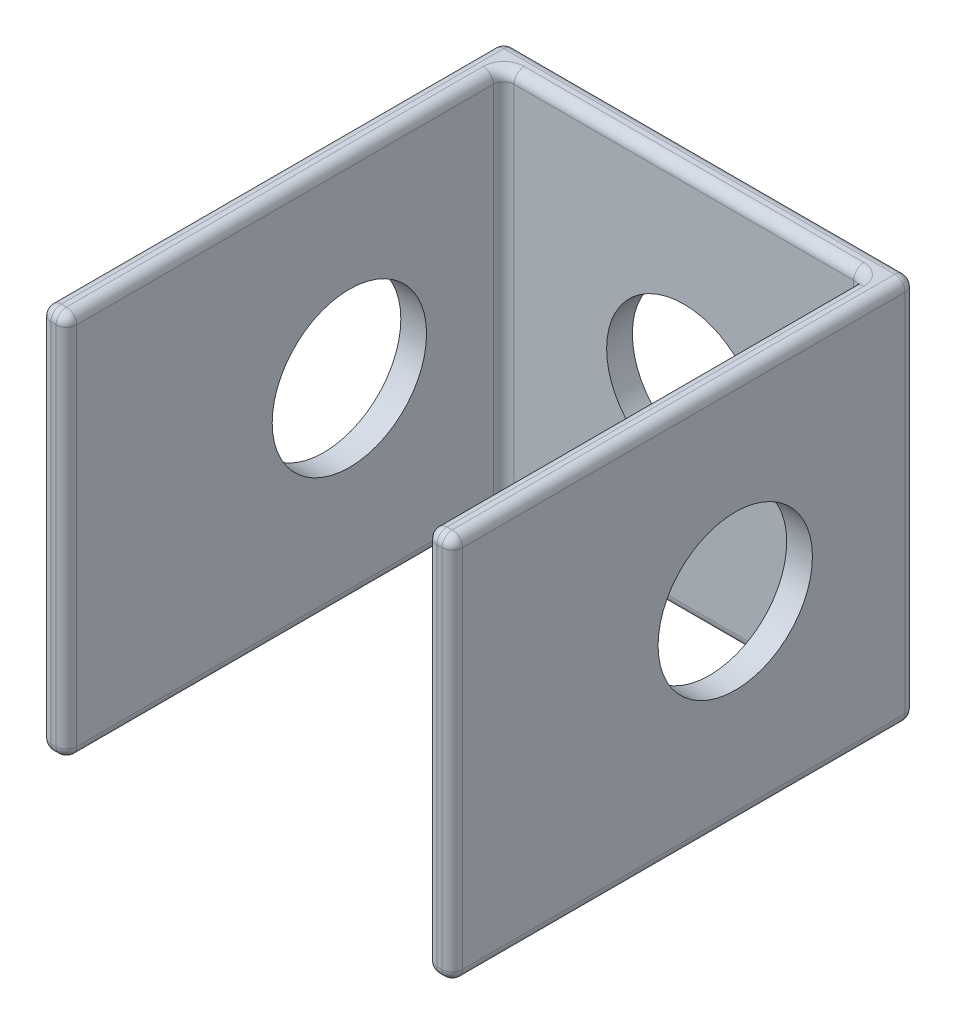
from build123d import *

# Parameters (mm, degrees)
SKETCH1_W           = 80
SKETCH1_H           = 90
BOSS_EXTRUDE1_DEPTH = 75
SKETCH2_W           = 70
SKETCH2_H           = 85
CUT_EXTRUDE2_DEPTH  = 142.862609591
SKETCH3_R           = 15
CUT_EXTRUDE3_DEPTH  = 142.862609591
SKETCH4_R           = 15
CUT_EXTRUDE4_DEPTH  = 139.744369255
FILLET1_R           = 2


with BuildPart() as part:
    # Sketch1 → Boss-Extrude1 (new body)
    with BuildSketch(Plane(origin=(0, 0, 0), x_dir=(1, 0, 0), z_dir=(0, 1, 0))):
        with Locations((40, 45)):
            Rectangle(SKETCH1_W, SKETCH1_H)
    extrude(amount=BOSS_EXTRUDE1_DEPTH)

    # Sketch2 → Cut-Extrude2 (cut, through all)
    with BuildSketch(Plane(origin=(0, 75, 0), x_dir=(1, 0, 0), z_dir=(0, 1, 0))):
        with Locations((40, 42.5)):
            Rectangle(SKETCH2_W, SKETCH2_H)
    extrude(amount=-CUT_EXTRUDE2_DEPTH, mode=Mode.SUBTRACT)

    # Sketch3 → Cut-Extrude3 (cut, through all)
    with BuildSketch(Plane.ZY):
        with Locations((-55, 37.5)):
            Circle(SKETCH3_R)
    extrude(amount=-CUT_EXTRUDE3_DEPTH, mode=Mode.SUBTRACT)

    # Sketch4 → Cut-Extrude4 (cut, through all)
    with BuildSketch(Plane.XY.offset(-85)):
        with Locations((40, 37.5)):
            Circle(SKETCH4_R)
    extrude(amount=-CUT_EXTRUDE4_DEPTH, mode=Mode.SUBTRACT)

    # Fillet1
    fillet1_edges = [part.edges().sort_by_distance(p)[0] for p in [
        (80, 75, -45),
        (77.5, 0, 0),
        (40, 75, -90),
        (77.5, 75, 0),
        (75, 37.5, 0),
        (5, 0, -42.5),
        (5, 37.5, 0),
        (40, 0, -85),
        (5, 37.5, -85),
        (75, 0, -42.5),
        (75, 37.5, -85),
        (75, 75, -42.5),
        (40, 75, -85),
        (5, 75, -42.5),
        (0, 75, -45),
        (40, 0, -90),
        (80, 0, -45),
        (2.5, 0, 0),
        (0, 0, -45),
        (0, 37.5, -90),
        (80, 37.5, -90),
        (80, 37.5, 0),
        (0, 37.5, 0),
        (2.5, 75, 0),
    ]]
    fillet(fillet1_edges, radius=FILLET1_R)


solid = part.part
